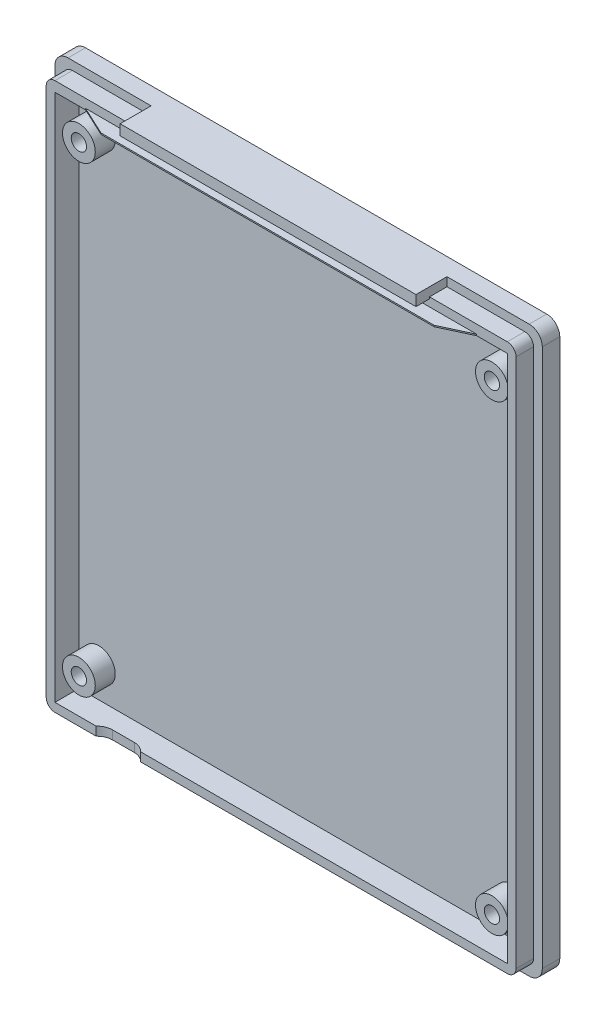
from build123d import *

# Parameters (mm, degrees)
DODANIE_WYCI_GNI_CIE1_DEPTH      = 0.5
DODANIE_WYCI_GNI_CIE1_DEPTH_BACK = 2
DODANIE_WYCI_GNI_CIE2_DEPTH      = 5.5
DODANIE_WYCI_GNI_CIE3_DEPTH      = 1.5
ZAOKR_GLENIE1_R                  = 2
SZKIC6_W                         = 67.685530181
SZKIC6_H                         = 2.4
DODANIE_WYCI_GNI_CIE4_DEPTH      = 8.59
DODANIE_WYCI_GNI_CIE5_DEPTH      = 8.59
WYTNIJ_WYCI_GNI_CIE1_DEPTH       = 5.5
SZKIC13_R                        = 3.75
SZKIC13_R_2                      = 1.75
DODANIE_WYCI_GNI_CIE7_DEPTH      = 4.57
SZKIC13_3_R                      = 1.75
WYTNIJ_WYCI_GNI_CIE2_DEPTH       = 90.286037732
WYTNIJ_WYCI_GNI_CIE3_DEPTH       = 2
SFAZOWANIE1_SIZE                 = 1.5
ZAOKR_GLENIE2_R                  = 3


with BuildPart() as part:
    # Szkic3 → Dodanie-wyciągnięcie1 (new, two sides: drawn at the far end of the back side and taken through both)
    with BuildSketch(Plane(origin=(0, 0, -8.74), x_dir=(-1, 0, 0), z_dir=(0, 0, -1)).offset(-DODANIE_WYCI_GNI_CIE1_DEPTH_BACK)):
        Polygon((55.692889856, -69.15246634), (55.692892168, 60.038263946), (-55.811722529, 60.038263946), (-55.811687853, -69.161116694), align=None)
    extrude(amount=DODANIE_WYCI_GNI_CIE1_DEPTH + DODANIE_WYCI_GNI_CIE1_DEPTH_BACK)

    # Szkic4 → Dodanie-wyciągnięcie2 (add)
    with BuildSketch(Plane.XY.offset(-6.74)):
        Polygon((53.802147291, -67.151419689), (53.80218089, 58.038263946), (-53.683348754, 58.038263946), (-53.683348754, -67.143081129), align=None)
        Polygon((51.802147827, -65.151264526), (51.802180354, 56.038263946), (-51.683348754, 56.038263946), (-51.683348754, -65.14323628), align=None, mode=Mode.SUBTRACT)
    extrude(amount=DODANIE_WYCI_GNI_CIE2_DEPTH)

    # Szkic4<3> → Dodanie-wyciągnięcie3 (add)
    with BuildSketch(Plane.XY.offset(-6.74)):
        Polygon((-55.692892168, 60.038263946), (-55.692889856, -69.15246634), (55.811687853, -69.161116694), (55.811722529, 60.038263946), align=None)
        Polygon((-53.683348754, -67.143081129), (-53.683348754, 58.038263946), (53.80218089, 58.038263946), (53.802147291, -67.151419689), align=None, mode=Mode.SUBTRACT)
    extrude(amount=DODANIE_WYCI_GNI_CIE3_DEPTH)

    # Zaokrąglenie1
    zaokr_glenie1_edges = [part.edges().sort_by_distance(p)[0] for p in [
        (53.80218089, 58.038263946, -3.24),
        (-53.683348754, 58.038263946, -3.24),
        (-53.683348754, -67.143081129, -3.24),
        (53.802147291, -67.151419689, -3.24),
    ]]
    fillet(zaokr_glenie1_edges, radius=ZAOKR_GLENIE1_R)

    # Szkic6 → Dodanie-wyciągnięcie4 (add)
    with BuildSketch(Plane.XY.offset(-6.74)):
        with Locations((0.159416337, 58.838263946)):
            Rectangle(SZKIC6_W, SZKIC6_H)
    extrude(amount=DODANIE_WYCI_GNI_CIE4_DEPTH)

    # Szkic7 → Dodanie-wyciągnięcie5 (add)
    with BuildSketch(Plane.XY.offset(-6.74)):
        Polygon((-51.683348754, 55.738263946), (51.802180273, 55.738263946), (51.802180354, 56.038263946), (-51.683348754, 56.038263946), align=None)
    extrude(amount=DODANIE_WYCI_GNI_CIE5_DEPTH)

    # Szkic9 → Wytnij-wyciągnięcie1 (cut)
    with BuildSketch(Plane.XZ.offset(-55.738263946)):
        Polygon((51.802180273, 1.85), (38.175466286, 1.85), (44.80199267, -1.24), (51.80199267, -1.24), (51.802180273, -1.24), align=None)
        Polygon((-38.056977527, 1.85), (-51.683348754, 1.85), (-51.683348754, -1.24), (-44.683503911, -1.24), align=None)
    extrude(amount=-WYTNIJ_WYCI_GNI_CIE1_DEPTH, mode=Mode.SUBTRACT)

    # Szkic13 → Dodanie-wyciągnięcie7 (add)
    # profile 1 of 4: a face of its own
    with BuildSketch(Plane.XY.offset(-6.74)):
        with Locations((-47.14, 47.6022)):
            Circle(SZKIC13_R)
        with Locations((-47.14, 47.6022)):
            Circle(SZKIC13_R_2, mode=Mode.SUBTRACT)
    # profile 2 of 4: a face of its own
    with BuildSketch(Plane.XY.offset(-6.74)):
        with Locations((47.352, 47.6022)):
            Circle(SZKIC13_R)
        with Locations((47.352, 47.6022)):
            Circle(SZKIC13_R_2, mode=Mode.SUBTRACT)
    # profile 3 of 4: a face of its own
    with BuildSketch(Plane.XY.offset(-6.74)):
        with Locations((-47.14, -58.1478)):
            Circle(SZKIC13_R)
        with Locations((-47.14, -58.1478)):
            Circle(SZKIC13_R_2, mode=Mode.SUBTRACT)
    # profile 4 of 4: a face of its own
    with BuildSketch(Plane.XY.offset(-6.74)):
        with Locations((47.352, -58.1478)):
            Circle(SZKIC13_R)
        with Locations((47.352, -58.1478)):
            Circle(SZKIC13_R_2, mode=Mode.SUBTRACT)
    extrude(amount=DODANIE_WYCI_GNI_CIE7_DEPTH)

    # Szkic13<3> → Wytnij-wyciągnięcie2 (cut, through all)
    with BuildSketch(Plane.XY.offset(-6.74)):
        with Locations((-47.14, -58.1478)):
            Circle(SZKIC13_3_R)
        with Locations((-47.14, 47.6022)):
            Circle(SZKIC13_3_R)
        with Locations((47.352, 47.6022)):
            Circle(SZKIC13_3_R)
        with Locations((47.352, -58.1478)):
            Circle(SZKIC13_3_R)
    extrude(amount=-WYTNIJ_WYCI_GNI_CIE2_DEPTH, mode=Mode.SUBTRACT)

    # Szkic18 → Wytnij-wyciągnięcie3 (cut)
    with BuildSketch(Plane(origin=(-0.00520918, -67.147245397, 0), x_dir=(0.999999996990791, -7.757846392237927e-05, 0), z_dir=(-7.757846392237927e-05, -0.999999996990791, 0))):
        with BuildLine():
            ThreePointArc((-42.245261471, -1.24), (-41.074504923, -2.078778872), (-39.665102055, -2.375097025))
            Line((-39.665102055, -2.375097025), (-34.665098037, -2.375097025))
            ThreePointArc((-34.665098037, -2.375097025), (-33.255694971, -2.078778946), (-32.084938256, -1.24))
            Line((-32.084938256, -1.24), (-42.245261471, -1.24))
        make_face()
    extrude(amount=-WYTNIJ_WYCI_GNI_CIE3_DEPTH, mode=Mode.SUBTRACT)

    # Sfazowanie1
    sfazowanie1_edges = [part.edges().sort_by_distance(p)[0] for p in [
        (45.602, -58.1478, -9.24),
        (45.602, 47.6022, -9.24),
        (-48.89, 47.6022, -9.24),
        (-48.89, -58.1478, -9.24),
    ]]
    chamfer(sfazowanie1_edges, length=SFAZOWANIE1_SIZE)

    # Zaokrąglenie2
    zaokr_glenie2_edges = [part.edges().sort_by_distance(p)[0] for p in [
        (55.811687853, -69.161116694, -7.24),
        (55.811722529, 60.038263946, -7.24),
        (-55.692892168, 60.038263946, -7.24),
        (-55.692889856, -69.15246634, -7.24),
    ]]
    fillet(zaokr_glenie2_edges, radius=ZAOKR_GLENIE2_R)


solid = part.part
